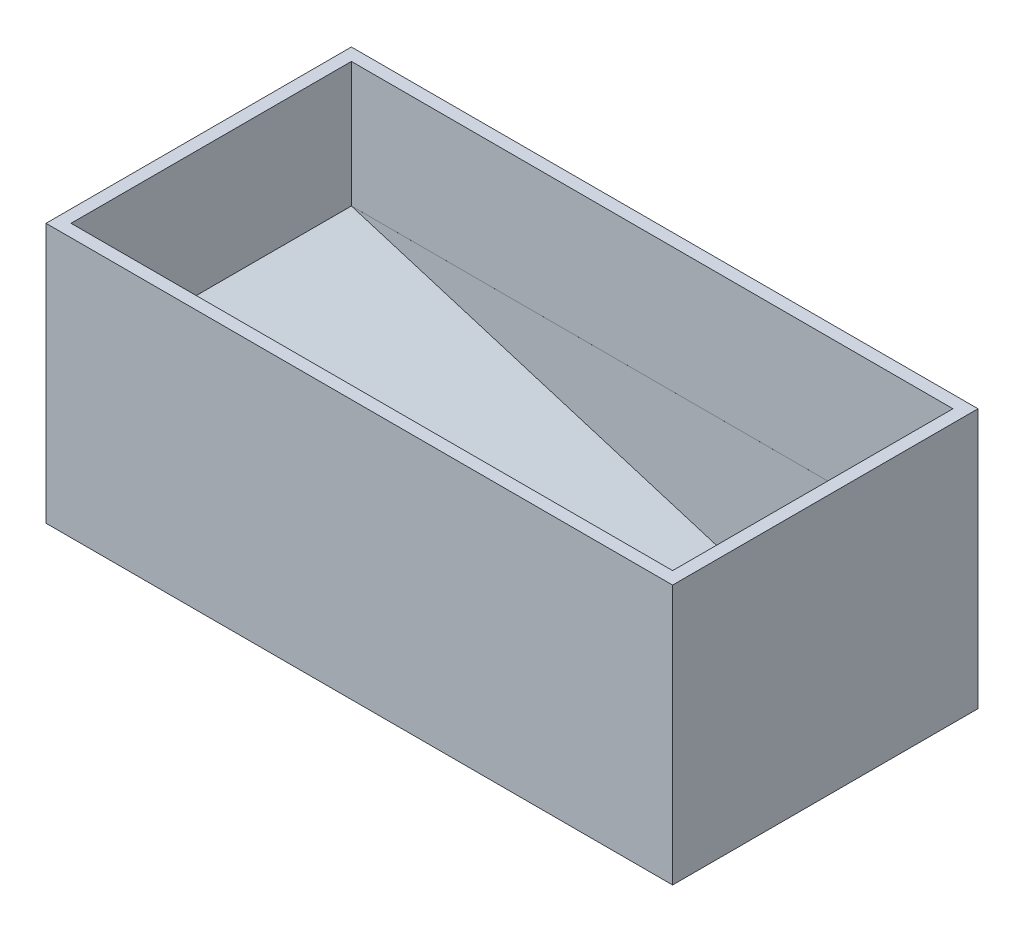
from build123d import *

# Parameters (mm, degrees)
SKETCH1_W            = 200.21
SKETCH1_H            = 97.58
BOSS_EXTRUDE1_DEPTH  = 43
SKETCH2_R            = 30.26
CUT_EXTRUDE1_DEPTH   = 43
SKETCH3_W            = 61.02
SKETCH3_H            = 89.58
CUT_EXTRUDE4_DEPTH   = 40
SKETCH6_W            = 131.19
SKETCH6_H            = 89.58
CUT_EXTRUDE6_DEPTH   = 40
BOSS_EXTRUDE2_DEPTH  = 92
SKETCH10_W           = 200.21
SKETCH10_H           = 4.004947158
BOSS_EXTRUDE3_DEPTH  = 40
SKETCH11_W           = 3.997887423
SKETCH11_H           = 93.575052842
BOSS_EXTRUDE4_DEPTH  = 40
SKETCH14_W           = 198.22617176
SKETCH14_H           = 3.997974015
BOSS_EXTRUDE8_DEPTH  = 40
SKETCH15_W           = 4.000744024
SKETCH15_H           = 90.67582921
BOSS_EXTRUDE9_DEPTH  = 40
CUT_EXTRUDE7_DEPTH   = 93.53
SKETCH17_W           = 133.33152703
SKETCH17_H           = 4
BOSS_EXTRUDE10_DEPTH = 45
SKETCH18_W           = 19.990768927
SKETCH18_H           = 67.482432085
CUT_EXTRUDE8_DEPTH   = 45
SKETCH19_W           = 130.204698474
SKETCH19_H           = 63.111611145
CUT_EXTRUDE9_DEPTH   = 45
BOSS_EXTRUDE11_DEPTH = 10
BOSS_EXTRUDE12_DEPTH = 10


with BuildPart() as part:
    # Sketch1 → Boss-Extrude1 (new body)
    with BuildSketch(Plane(origin=(0, 0, 0), x_dir=(1, 0, 0), z_dir=(0, 1, 0))):
        with Locations((100.105, 48.79)):
            Rectangle(SKETCH1_W, SKETCH1_H)
    extrude(amount=BOSS_EXTRUDE1_DEPTH)

    # Sketch2 → Cut-Extrude1 (cut)
    with BuildSketch(Plane(origin=(0, 43, 0), x_dir=(1, 0, 0), z_dir=(0, 1, 0))):
        with Locations(Location((165.7, 49.98, 0), (0, 0, 270))):
            Circle(SKETCH2_R)
    extrude(amount=-CUT_EXTRUDE1_DEPTH, mode=Mode.SUBTRACT)

    # Sketch3 → Cut-Extrude4 (cut)
    with BuildSketch(Plane(origin=(0, 43, 0), x_dir=(1, 0, 0), z_dir=(0, 1, 0))):
        with Locations((165.7, 48.79)):
            Rectangle(SKETCH3_W, SKETCH3_H)
    extrude(amount=-CUT_EXTRUDE4_DEPTH, mode=Mode.SUBTRACT)

    # Sketch6 → Cut-Extrude6 (cut)
    with BuildSketch(Plane(origin=(0, 43, 0), x_dir=(1, 0, 0), z_dir=(0, 1, 0))):
        with Locations((69.595, 48.79)):
            Rectangle(SKETCH6_W, SKETCH6_H)
    extrude(amount=-CUT_EXTRUDE6_DEPTH, mode=Mode.SUBTRACT)

    # Sketch9 → Boss-Extrude2 (add)
    with BuildSketch(Plane.XY.offset(-93.58)):
        Polygon((4, 3), (135.19, 3), (4, 43), align=None)
    extrude(amount=BOSS_EXTRUDE2_DEPTH)

    # Sketch10 → Boss-Extrude3 (add)
    with BuildSketch(Plane(origin=(0, 43, 0), x_dir=(1, 0, 0), z_dir=(0, 1, 0))):
        with Locations((100.105, 2.002473579)):
            Rectangle(SKETCH10_W, SKETCH10_H)
    extrude(amount=BOSS_EXTRUDE3_DEPTH)

    # Sketch11 → Boss-Extrude4 (add)
    with BuildSketch(Plane(origin=(0, 43, 0), x_dir=(1, 0, 0), z_dir=(0, 1, 0))):
        with Locations((1.998943712, 50.792473579)):
            Rectangle(SKETCH11_W, SKETCH11_H)
    extrude(amount=BOSS_EXTRUDE4_DEPTH)

    # Sketch14 → Boss-Extrude8 (add)
    with BuildSketch(Plane(origin=(0, 43, 0), x_dir=(1, 0, 0), z_dir=(0, 1, 0))):
        with Locations((101.09691412, 95.581012993)):
            Rectangle(SKETCH14_W, SKETCH14_H)
    extrude(amount=BOSS_EXTRUDE8_DEPTH)

    # Sketch15 → Boss-Extrude9 (add)
    with BuildSketch(Plane(origin=(0, 43, 0), x_dir=(1, 0, 0), z_dir=(0, 1, 0))):
        with Locations((198.209627988, 49.342861763)):
            Rectangle(SKETCH15_W, SKETCH15_H)
    extrude(amount=BOSS_EXTRUDE9_DEPTH)

    # Sketch16 → Cut-Extrude7 (cut)
    with BuildSketch(Plane(origin=(0, 0, -97.58), x_dir=(-1, 0, 0), z_dir=(0, 0, -1))):
        Polygon((0, 0), (-127.19, 0), (0, 40), align=None)
    extrude(amount=-CUT_EXTRUDE7_DEPTH, mode=Mode.SUBTRACT)

    # Sketch17 → Boss-Extrude10 (add)
    with BuildSketch(Plane(origin=(11.44741016, 36.399902458, 0), x_dir=(0.9539379232634473, -0.30000406423883874, 0), z_dir=(-0.30000406423883874, -0.9539379232634474, 0))):
        with Locations((54.665600945, -95.58)):
            Rectangle(SKETCH17_W, SKETCH17_H)
    extrude(amount=BOSS_EXTRUDE10_DEPTH)

    # Sketch18 → Cut-Extrude8 (cut)
    with BuildSketch(Plane(origin=(0, 0, -97.58), x_dir=(-1, 0, 0), z_dir=(0, 0, -1))):
        with Locations((9.995384464, 19.727595476)):
            Rectangle(SKETCH18_W, SKETCH18_H)
    extrude(amount=-CUT_EXTRUDE8_DEPTH, mode=Mode.SUBTRACT)

    # Sketch19 → Cut-Extrude9 (cut)
    with BuildSketch(Plane(origin=(0, 0, -97.58), x_dir=(-1, 0, 0), z_dir=(0, 0, -1))):
        with Locations((-62.087650763, -31.555805573)):
            Rectangle(SKETCH19_W, SKETCH19_H)
    extrude(amount=-CUT_EXTRUDE9_DEPTH, mode=Mode.SUBTRACT)

    # Sketch20 → Boss-Extrude11 (add)
    with BuildSketch(Plane(origin=(0, 0, -4.05), x_dir=(-1, 0, 0), z_dir=(0, 0, -1))):
        Polygon((0, 0), (0, 2), (-120.8305, 2), (-127.19, 0), align=None)
    extrude(amount=BOSS_EXTRUDE11_DEPTH)

    # Sketch21 → Boss-Extrude12 (add)
    with BuildSketch(Plane.XY.offset(-93.58)):
        Polygon((0, 0), (0, 2), (120.8305, 2), (127.19, 0), align=None)
    extrude(amount=BOSS_EXTRUDE12_DEPTH)


solid = part.part
